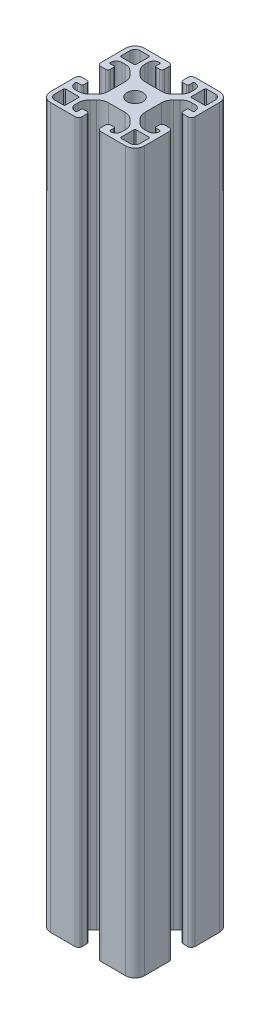
from build123d import *

# Parameters (mm, degrees)
SZKIC2_R                    = 3.4
DODANIE_WYCI_GNI_CIE2_DEPTH = 153


with BuildPart() as part:
    # Szkic2 → Dodanie-wyciągnięcie2 (new, symmetric)
    with BuildSketch(Plane(origin=(0, 0, 0), x_dir=(1, 0, 0), z_dir=(0, 1, 0))):
        with BuildLine():
            Line((-16, 20), (-5.499994708, 20))
            ThreePointArc((-5.499994708, 20), (-4.439334536, 19.560660172), (-3.999994708, 18.5))
            Line((-3.999994708, 18.5), (-3.999994708, 16.5))
            ThreePointArc((-3.999994708, 16.5), (-4.292887927, 15.792893219), (-4.999994708, 15.5))
            Line((-4.999994708, 15.5), (-6.499994708, 15.5))
            ThreePointArc((-6.499994708, 15.5), (-6.853548099, 15.646446609), (-6.999994708, 16))
            Line((-6.999994708, 16), (-6.999994708, 17.5))
            ThreePointArc((-6.999994708, 17.5), (-7.14644085, 17.853552923), (-7.499993385, 18))
            ThreePointArc((-7.499993385, 18), (-9.267764614, 17.267769292), (-10, 15.5))
            Line((-10, 15.5), (-10, 14.171067812))
            ThreePointArc((-10, 14.171067812), (-9.619397663, 12.25765065), (-8.535533906, 10.635533906))
            Line((-8.535533906, 10.635533906), (-7.114466094, 9.214466094))
            ThreePointArc((-7.114466094, 9.214466094), (-5.49234935, 8.130602337), (-3.578932188, 7.75))
            Line((-3.578932188, 7.75), (3.578932188, 7.75))
            ThreePointArc((3.578932188, 7.75), (5.49234935, 8.130602337), (7.114466094, 9.214466094))
            Line((7.114466094, 9.214466094), (8.535533906, 10.635533906))
            ThreePointArc((8.535533906, 10.635533906), (9.619397663, 12.25765065), (10, 14.171067812))
            Line((10, 14.171067812), (10, 15.5))
            ThreePointArc((10, 15.5), (9.267769292, 17.267764614), (7.500006615, 18))
            ThreePointArc((7.500006615, 18), (7.146452369, 17.853553858), (7.000005292, 17.5))
            Line((7.000005292, 17.5), (7.000005292, 16))
            ThreePointArc((7.000005292, 16), (6.853558682, 15.646446609), (6.500005292, 15.5))
            Line((6.500005292, 15.5), (5.000005292, 15.5))
            ThreePointArc((5.000005292, 15.5), (4.292898511, 15.792893219), (4.000005292, 16.5))
            Line((4.000005292, 16.5), (4.000005292, 18.5))
            ThreePointArc((4.000005292, 18.5), (4.43934512, 19.560660172), (5.500005292, 20))
            Line((5.500005292, 20), (16, 20))
            ThreePointArc((16, 20), (18.828427125, 18.828427125), (20, 16))
            Line((20, 16), (20, 5.499994708))
            ThreePointArc((20, 5.499994708), (19.560660172, 4.439334536), (18.5, 3.999994708))
            Line((18.5, 3.999994708), (16.5, 3.999994708))
            ThreePointArc((16.5, 3.999994708), (15.792893219, 4.292887927), (15.5, 4.999994708))
            Line((15.5, 4.999994708), (15.5, 6.499994708))
            ThreePointArc((15.5, 6.499994708), (15.646446609, 6.853548099), (16, 6.999994708))
            Line((16, 6.999994708), (17.5, 6.999994708))
            ThreePointArc((17.5, 6.999994708), (17.853552923, 7.14644085), (18, 7.499993385))
            ThreePointArc((18, 7.499993385), (17.267769292, 9.267764614), (15.5, 10))
            Line((15.5, 10), (14.171067812, 10))
            ThreePointArc((14.171067812, 10), (12.25765065, 9.619397663), (10.635533906, 8.535533906))
            Line((10.635533906, 8.535533906), (9.214466094, 7.114466094))
            ThreePointArc((9.214466094, 7.114466094), (8.130602337, 5.49234935), (7.75, 3.578932188))
            Line((7.75, 3.578932188), (7.75, -3.578932188))
            ThreePointArc((7.75, -3.578932188), (8.130602337, -5.49234935), (9.214466094, -7.114466094))
            Line((9.214466094, -7.114466094), (10.635533906, -8.535533906))
            ThreePointArc((10.635533906, -8.535533906), (12.25765065, -9.619397663), (14.171067812, -10))
            Line((14.171067812, -10), (15.5, -10))
            ThreePointArc((15.5, -10), (17.267764614, -9.267769292), (18, -7.500006615))
            ThreePointArc((18, -7.500006615), (17.853553858, -7.146452369), (17.5, -7.000005292))
            Line((17.5, -7.000005292), (16, -7.000005292))
            ThreePointArc((16, -7.000005292), (15.646446609, -6.853558682), (15.5, -6.500005292))
            Line((15.5, -6.500005292), (15.5, -5.000005292))
            ThreePointArc((15.5, -5.000005292), (15.792893219, -4.292898511), (16.5, -4.000005292))
            Line((16.5, -4.000005292), (18.5, -4.000005292))
            ThreePointArc((18.5, -4.000005292), (19.560660172, -4.43934512), (20, -5.500005292))
            Line((20, -5.500005292), (20, -16))
            ThreePointArc((20, -16), (18.828427125, -18.828427125), (16, -20))
            Line((16, -20), (5.499994708, -20))
            ThreePointArc((5.499994708, -20), (4.439334536, -19.560660172), (3.999994708, -18.5))
            Line((3.999994708, -18.5), (3.999994708, -16.5))
            ThreePointArc((3.999994708, -16.5), (4.292887927, -15.792893219), (4.999994708, -15.5))
            Line((4.999994708, -15.5), (6.499994708, -15.5))
            ThreePointArc((6.499994708, -15.5), (6.853548099, -15.646446609), (6.999994708, -16))
            Line((6.999994708, -16), (6.999994708, -17.5))
            ThreePointArc((6.999994708, -17.5), (7.14644085, -17.853552923), (7.499993385, -18))
            ThreePointArc((7.499993385, -18), (9.267764614, -17.267769292), (10, -15.5))
            Line((10, -15.5), (10, -14.171067812))
            ThreePointArc((10, -14.171067812), (9.619397663, -12.25765065), (8.535533906, -10.635533906))
            Line((8.535533906, -10.635533906), (7.114466094, -9.214466094))
            ThreePointArc((7.114466094, -9.214466094), (5.49234935, -8.130602337), (3.578932188, -7.75))
            Line((3.578932188, -7.75), (-3.578932188, -7.75))
            ThreePointArc((-3.578932188, -7.75), (-5.49234935, -8.130602337), (-7.114466094, -9.214466094))
            Line((-7.114466094, -9.214466094), (-8.535533906, -10.635533906))
            ThreePointArc((-8.535533906, -10.635533906), (-9.619397663, -12.25765065), (-10, -14.171067812))
            Line((-10, -14.171067812), (-10, -15.5))
            ThreePointArc((-10, -15.5), (-9.267769292, -17.267764614), (-7.500006615, -18))
            ThreePointArc((-7.500006615, -18), (-7.146452369, -17.853553858), (-7.000005292, -17.5))
            Line((-7.000005292, -17.5), (-7.000005292, -16))
            ThreePointArc((-7.000005292, -16), (-6.853558682, -15.646446609), (-6.500005292, -15.5))
            Line((-6.500005292, -15.5), (-5.000005292, -15.5))
            ThreePointArc((-5.000005292, -15.5), (-4.292898511, -15.792893219), (-4.000005292, -16.5))
            Line((-4.000005292, -16.5), (-4.000005292, -18.5))
            ThreePointArc((-4.000005292, -18.5), (-4.43934512, -19.560660172), (-5.500005292, -20))
            Line((-5.500005292, -20), (-16, -20))
            ThreePointArc((-16, -20), (-18.828427125, -18.828427125), (-20, -16))
            Line((-20, -16), (-20, -5.499994708))
            ThreePointArc((-20, -5.499994708), (-19.560660172, -4.439334536), (-18.5, -3.999994708))
            Line((-18.5, -3.999994708), (-16.5, -3.999994708))
            ThreePointArc((-16.5, -3.999994708), (-15.792893219, -4.292887927), (-15.5, -4.999994708))
            Line((-15.5, -4.999994708), (-15.5, -6.499994708))
            ThreePointArc((-15.5, -6.499994708), (-15.646446609, -6.853548099), (-16, -6.999994708))
            Line((-16, -6.999994708), (-17.5, -6.999994708))
            ThreePointArc((-17.5, -6.999994708), (-17.853552923, -7.14644085), (-18, -7.499993385))
            ThreePointArc((-18, -7.499993385), (-17.267769292, -9.267764614), (-15.5, -10))
            Line((-15.5, -10), (-14.171067812, -10))
            ThreePointArc((-14.171067812, -10), (-12.25765065, -9.619397663), (-10.635533906, -8.535533906))
            Line((-10.635533906, -8.535533906), (-9.214466094, -7.114466094))
            ThreePointArc((-9.214466094, -7.114466094), (-8.130602337, -5.49234935), (-7.75, -3.578932188))
            Line((-7.75, -3.578932188), (-7.75, 3.578932188))
            ThreePointArc((-7.75, 3.578932188), (-8.130602337, 5.49234935), (-9.214466094, 7.114466094))
            Line((-9.214466094, 7.114466094), (-10.635533906, 8.535533906))
            ThreePointArc((-10.635533906, 8.535533906), (-12.25765065, 9.619397663), (-14.171067812, 10))
            Line((-14.171067812, 10), (-15.5, 10))
            ThreePointArc((-15.5, 10), (-17.267764614, 9.267769292), (-18, 7.500006615))
            ThreePointArc((-18, 7.500006615), (-17.853553858, 7.146452369), (-17.5, 7.000005292))
            Line((-17.5, 7.000005292), (-16, 7.000005292))
            ThreePointArc((-16, 7.000005292), (-15.646446609, 6.853558682), (-15.5, 6.500005292))
            Line((-15.5, 6.500005292), (-15.5, 5.000005292))
            ThreePointArc((-15.5, 5.000005292), (-15.792893219, 4.292898511), (-16.5, 4.000005292))
            Line((-16.5, 4.000005292), (-18.5, 4.000005292))
            ThreePointArc((-18.5, 4.000005292), (-19.560660172, 4.43934512), (-20, 5.500005292))
            Line((-20, 5.500005292), (-20, 16))
            ThreePointArc((-20, 16), (-18.828427125, 18.828427125), (-16, 20))
        make_face()
        Circle(SZKIC2_R, mode=Mode.SUBTRACT)
        with BuildLine():
            Line((-11.8, -17.7), (-11.8, -12.3))
            ThreePointArc((-11.8, -12.3), (-11.946446609, -11.946446609), (-12.3, -11.8))
            Line((-12.3, -11.8), (-17.7, -11.8))
            ThreePointArc((-17.7, -11.8), (-18.053553391, -11.946446609), (-18.2, -12.3))
            Line((-18.2, -12.3), (-18.2, -16))
            ThreePointArc((-18.2, -16), (-17.555634919, -17.555634919), (-16, -18.2))
            Line((-16, -18.2), (-12.3, -18.2))
            ThreePointArc((-12.3, -18.2), (-11.946446609, -18.053553391), (-11.8, -17.7))
        make_face(mode=Mode.SUBTRACT)
        with BuildLine():
            Line((17.7, -11.8), (12.3, -11.8))
            ThreePointArc((12.3, -11.8), (11.946446609, -11.946446609), (11.8, -12.3))
            Line((11.8, -12.3), (11.8, -17.7))
            ThreePointArc((11.8, -17.7), (11.946446609, -18.053553391), (12.3, -18.2))
            Line((12.3, -18.2), (16, -18.2))
            ThreePointArc((16, -18.2), (17.555634919, -17.555634919), (18.2, -16))
            Line((18.2, -16), (18.2, -12.3))
            ThreePointArc((18.2, -12.3), (18.053553391, -11.946446609), (17.7, -11.8))
        make_face(mode=Mode.SUBTRACT)
        with BuildLine():
            Line((11.8, 17.7), (11.8, 12.3))
            ThreePointArc((11.8, 12.3), (11.946446609, 11.946446609), (12.3, 11.8))
            Line((12.3, 11.8), (17.7, 11.8))
            ThreePointArc((17.7, 11.8), (18.053553391, 11.946446609), (18.2, 12.3))
            Line((18.2, 12.3), (18.2, 16))
            ThreePointArc((18.2, 16), (17.555634919, 17.555634919), (16, 18.2))
            Line((16, 18.2), (12.3, 18.2))
            ThreePointArc((12.3, 18.2), (11.946446609, 18.053553391), (11.8, 17.7))
        make_face(mode=Mode.SUBTRACT)
        with BuildLine():
            Line((-11.8, 12.3), (-11.8, 17.7))
            ThreePointArc((-11.8, 17.7), (-11.946446609, 18.053553391), (-12.3, 18.2))
            Line((-12.3, 18.2), (-16, 18.2))
            ThreePointArc((-16, 18.2), (-17.555634919, 17.555634919), (-18.2, 16))
            Line((-18.2, 16), (-18.2, 12.3))
            ThreePointArc((-18.2, 12.3), (-18.053553391, 11.946446609), (-17.7, 11.8))
            Line((-17.7, 11.8), (-12.3, 11.8))
            ThreePointArc((-12.3, 11.8), (-11.946446609, 11.946446609), (-11.8, 12.3))
        make_face(mode=Mode.SUBTRACT)
    extrude(amount=DODANIE_WYCI_GNI_CIE2_DEPTH, both=True)


solid = part.part
